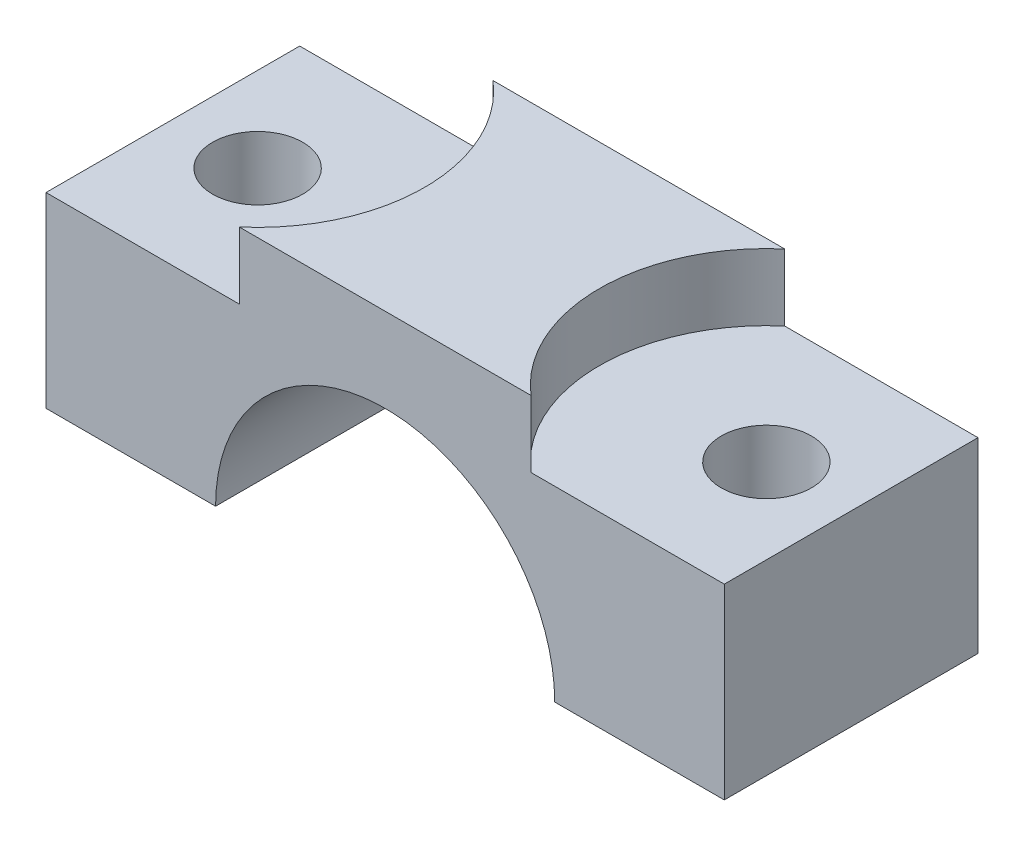
from build123d import *

# Parameters (mm, degrees)
BOSS_EXTRUDE1_DEPTH                           = 9.5
CBORE_FOR_M12_HEX_HEAD_CAP_SCREW1_D           = 6.75
CBORE_FOR_M12_HEX_HEAD_CAP_SCREW1_CBORE_D     = 25
CBORE_FOR_M12_HEX_HEAD_CAP_SCREW1_CBORE_DEPTH = 5


with BuildPart() as part:
    # Sketch1 → Boss-Extrude1 (new, symmetric)
    with BuildSketch(Plane.XY):
        with BuildLine():
            Line((12.7, 0), (25.4, 0))
            Line((25.4, 0), (25.4, 19))
            Line((25.4, 19), (-25.4, 19))
            Line((-25.4, 19), (-25.4, 0))
            Line((-25.4, 0), (-12.7, 0))
            ThreePointArc((-12.7, 0), (0, 12.7), (12.7, 0))
        make_face()
    extrude(amount=BOSS_EXTRUDE1_DEPTH, both=True)

    # CBORE for M12 Hex Head Cap Screw1 (through all)
    with Locations(Plane(origin=(0, 19, 0), x_dir=(1, 0, 0), z_dir=(0, 1, 0))):
        with Locations((19.05, 0), (-19.05, 0)):
            CounterBoreHole(CBORE_FOR_M12_HEX_HEAD_CAP_SCREW1_D / 2, CBORE_FOR_M12_HEX_HEAD_CAP_SCREW1_CBORE_D / 2, CBORE_FOR_M12_HEX_HEAD_CAP_SCREW1_CBORE_DEPTH)


solid = part.part
